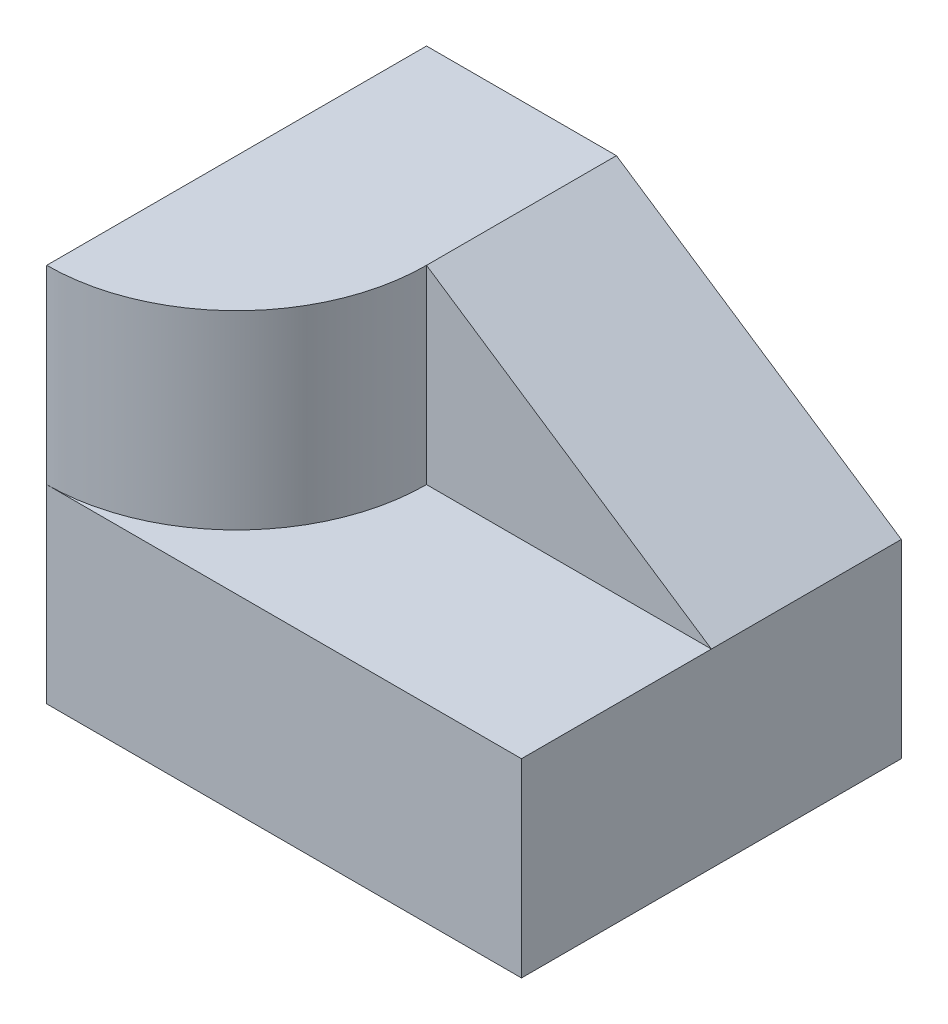
from build123d import *

# Parameters (mm, degrees)
SKETCH1_W           = 50
SKETCH1_H           = 40
BOSS_EXTRUDE1_DEPTH = 20
BOSS_EXTRUDE2_DEPTH = 20
BOSS_EXTRUDE3_DEPTH = 20


with BuildPart() as part:
    # Sketch1 → Boss-Extrude1 (new body)
    with BuildSketch(Plane(origin=(0, 0, 0), x_dir=(1, 0, 0), z_dir=(0, 1, 0))):
        Rectangle(SKETCH1_W, SKETCH1_H)
    extrude(amount=BOSS_EXTRUDE1_DEPTH)

    # Sketch2 → Boss-Extrude2 (add)
    with BuildSketch(Plane(origin=(0, 20, 0), x_dir=(1, 0, 0), z_dir=(0, 1, 0))):
        with BuildLine():
            Line((-25, 20), (-5, 20))
            Line((-5, 20), (-5, 0))
            ThreePointArc((-5, 0), (-10.857864376, -14.142135624), (-25, -20))
            Line((-25, -20), (-25, 20))
        make_face()
    extrude(amount=BOSS_EXTRUDE2_DEPTH)

    # Sketch3 → Boss-Extrude3 (add)
    with BuildSketch(Plane(origin=(0, 0, -20), x_dir=(-1, 0, 0), z_dir=(0, 0, -1))):
        Polygon((5, 40), (-25, 20), (5, 20), align=None)
    extrude(amount=-BOSS_EXTRUDE3_DEPTH)


solid = part.part
